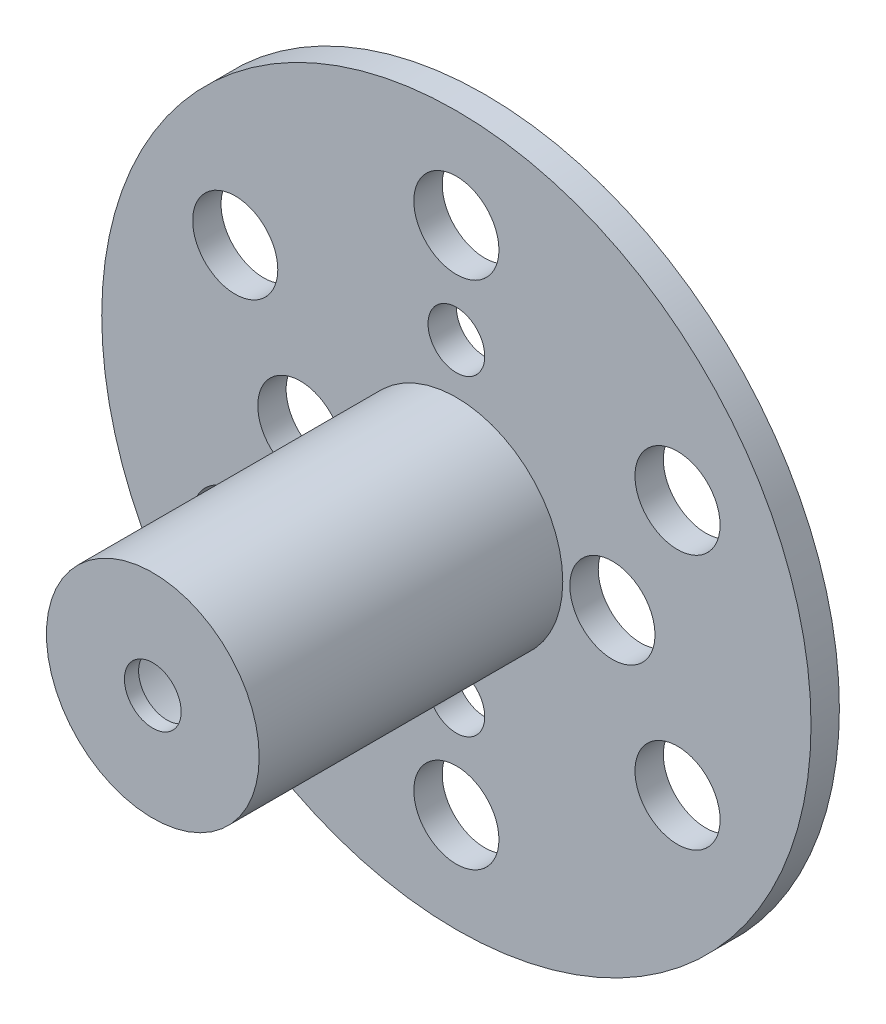
from build123d import *

# Parameters (mm, degrees)
SKETCH_1_R      = 12.5
SKETCH_1_R_2    = 2.75
SKETCH_1_R_3    = 1.5
SKETCH_1_R_4    = 1
EXTRUDE_1_DEPTH = 1
SKETCH_2_R      = 3.75
SKETCH_2_R_2    = 2.75
EXTRUDE_2_DEPTH = 10.2
SKETCH_3_R      = 3.75
SKETCH_3_R_2    = 1
EXTRUDE_3_DEPTH = 0.5


with BuildPart() as part:
    # Эскиз1 → Бобышка-Вытянуть1 (new body)
    with BuildSketch(Plane.XY):
        Circle(SKETCH_1_R)
        Circle(SKETCH_1_R_2, mode=Mode.SUBTRACT)
        with Locations((0, 9)):
            Circle(SKETCH_1_R_3, mode=Mode.SUBTRACT)
        with Locations((7.794228634, 4.5)):
            Circle(SKETCH_1_R_3, mode=Mode.SUBTRACT)
        with Locations((7.794228634, -4.5)):
            Circle(SKETCH_1_R_3, mode=Mode.SUBTRACT)
        with Locations((0, -9)):
            Circle(SKETCH_1_R_3, mode=Mode.SUBTRACT)
        with Locations((-7.794228634, -4.5)):
            Circle(SKETCH_1_R_3, mode=Mode.SUBTRACT)
        with Locations((-7.794228634, 4.5)):
            Circle(SKETCH_1_R_3, mode=Mode.SUBTRACT)
        with Locations((-5.5, 0)):
            Circle(SKETCH_1_R_3, mode=Mode.SUBTRACT)
        with Locations(Location((5.5, 0, 0), (0, 0, 180))):
            Circle(SKETCH_1_R_3, mode=Mode.SUBTRACT)
        with Locations((0, 5.5)):
            Circle(SKETCH_1_R_4, mode=Mode.SUBTRACT)
        with Locations(Location((0, -5.5, 0), (0, 0, 180))):
            Circle(SKETCH_1_R_4, mode=Mode.SUBTRACT)
    extrude(amount=EXTRUDE_1_DEPTH)

    # Эскиз2 → Бобышка-Вытянуть2 (add)
    with BuildSketch(Plane.XY.offset(1)):
        Circle(SKETCH_2_R)
        Circle(SKETCH_2_R_2, mode=Mode.SUBTRACT)
    extrude(amount=EXTRUDE_2_DEPTH)

    # Эскиз3 → Бобышка-Вытянуть3 (add)
    with BuildSketch(Plane.XY.offset(11.2)):
        Circle(SKETCH_3_R)
        Circle(SKETCH_3_R_2, mode=Mode.SUBTRACT)
    extrude(amount=EXTRUDE_3_DEPTH)


solid = part.part
